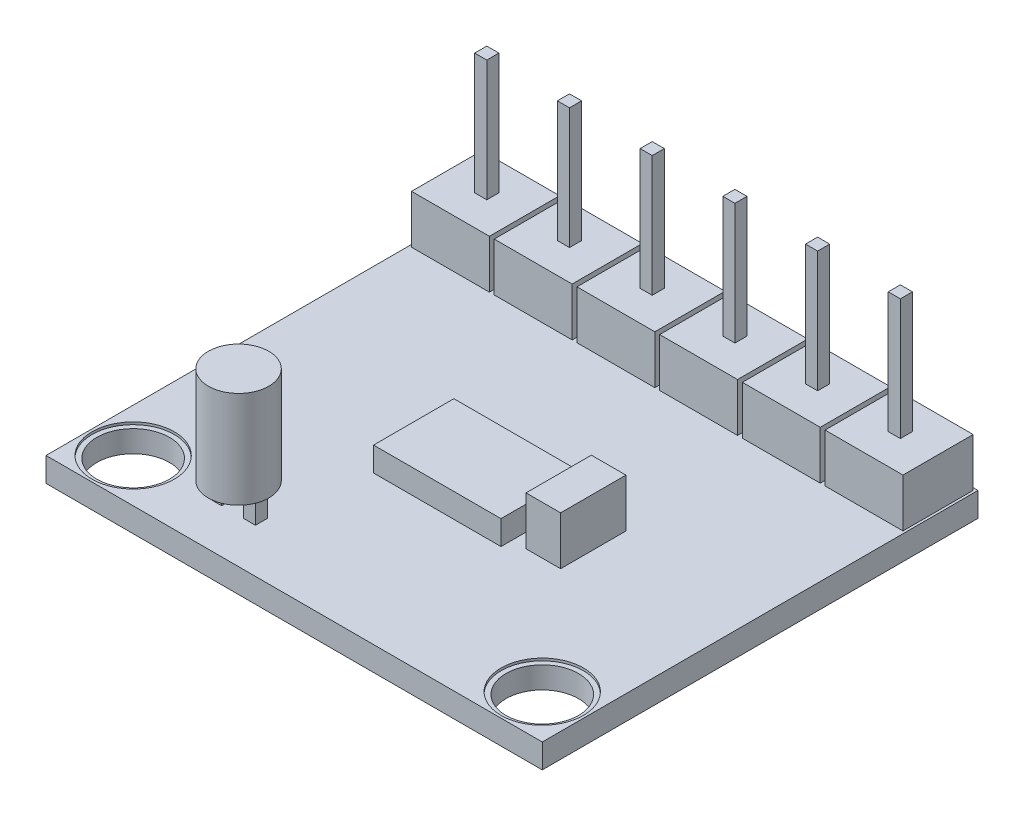
from build123d import *

# Parameters (mm, degrees)
SKETCH_1_W          = 20.5
SKETCH_1_H          = 18
EXTRUDE_1_DEPTH     = 1
SKETCH_2_W          = 3.216666667
SKETCH_2_H          = 3
SKETCH_2_W_2        = 3.216666666
EXTRUDE_2_DEPTH     = 2
SKETCH_3_W          = 0.5
SKETCH_3_H          = 0.5
EXTRUDE_3_DEPTH     = 5
EXTRUDE_3_2_DEPTH   = 5
EXTRUDE_3_3_DEPTH   = 5
EXTRUDE_3_4_DEPTH   = 5
EXTRUDE_3_5_DEPTH   = 5
EXTRUDE_3_6_DEPTH   = 5
SKETCH_4_W          = 20.3
SKETCH_4_H          = 0.1
CUT_EXTRUDE_1_DEPTH = 2
SKETCH_5_R          = 1.5
CUT_EXTRUDE_2_DEPTH = 22
SKETCH_6_R          = 1.7
SKETCH_6_R_2        = 1.5
CUT_EXTRUDE_3_DEPTH = 0.1
SKETCH_7_W          = 0.5
SKETCH_7_H          = 0.5
EXTRUDE_4_DEPTH     = 1
EXTRUDE_4_2_DEPTH   = 1
SKETCH_8_R          = 1.25
EXTRUDE_5_DEPTH     = 4
SKETCH_9_W          = 5.263405332
SKETCH_9_H          = 3.317744814
EXTRUDE_6_DEPTH     = 1
SKETCH_10_W         = 1.428317259
SKETCH_10_H         = 2.699182221
EXTRUDE_7_DEPTH     = 2


with BuildPart() as part:
    # 스케치1 → 보스-돌출1 (new body)
    with BuildSketch(Plane(origin=(0, 0, 0), x_dir=(1, 0, 0), z_dir=(0, 1, 0))):
        Rectangle(SKETCH_1_W, SKETCH_1_H)
    extrude(amount=EXTRUDE_1_DEPTH)

    # 스케치2 → 보스-돌출2 (add)
    with BuildSketch(Plane(origin=(0, 1, 0), x_dir=(1, 0, 0), z_dir=(0, 1, 0))):
        with Locations((-8.541666666, 7.5)):
            Rectangle(SKETCH_2_W, SKETCH_2_H)
        with Locations((-5.125, 7.5)):
            Rectangle(SKETCH_2_W_2, SKETCH_2_H)
        with Locations((-1.708333334, 7.5)):
            Rectangle(SKETCH_2_W, SKETCH_2_H)
        with Locations((1.708333334, 7.5)):
            Rectangle(SKETCH_2_W, SKETCH_2_H)
        with Locations((5.125, 7.5)):
            Rectangle(SKETCH_2_W_2, SKETCH_2_H)
        with Locations((8.541666666, 7.5)):
            Rectangle(SKETCH_2_W, SKETCH_2_H)
    extrude(amount=EXTRUDE_2_DEPTH)

    # 스케치4 → 컷-돌출1 (cut)
    with BuildSketch(Plane(origin=(0, 3, 0), x_dir=(1, 0, 0), z_dir=(0, 1, 0))):
        with Locations((0, 8.95)):
            Rectangle(SKETCH_4_W, SKETCH_4_H)
    extrude(amount=-CUT_EXTRUDE_1_DEPTH, mode=Mode.SUBTRACT)

    # 스케치5 → 컷-돌출2 (cut)
    with BuildSketch(Plane(origin=(0, 1, 0), x_dir=(1, 0, 0), z_dir=(0, 1, 0))):
        with Locations(Location((-8.45, -7.2, 0), (0, 0, 270))):
            Circle(SKETCH_5_R)
        with Locations(Location((8.45, -7.2, 0), (0, 0, 270))):
            Circle(SKETCH_5_R)
    extrude(amount=-CUT_EXTRUDE_2_DEPTH, mode=Mode.SUBTRACT)

    # 스케치6 → 컷-돌출3 (cut)
    # profile 1 of 2: a face of its own
    with BuildSketch(Plane(origin=(0, 1, 0), x_dir=(1, 0, 0), z_dir=(0, 1, 0))):
        with Locations(Location((-8.45, -7.2, 0), (0, 0, 270))):
            Circle(SKETCH_6_R)
        with Locations(Location((-8.45, -7.2, 0), (0, 0, 270))):
            Circle(SKETCH_6_R_2, mode=Mode.SUBTRACT)
    # profile 2 of 2: a face of its own
    with BuildSketch(Plane(origin=(0, 1, 0), x_dir=(1, 0, 0), z_dir=(0, 1, 0))):
        with Locations(Location((8.45, -7.2, 0), (0, 0, 270))):
            Circle(SKETCH_6_R)
        with Locations(Location((8.45, -7.2, 0), (0, 0, 270))):
            Circle(SKETCH_6_R_2, mode=Mode.SUBTRACT)
    extrude(amount=-CUT_EXTRUDE_3_DEPTH, mode=Mode.SUBTRACT)


with BuildPart() as body_2:
    # 스케치3 → 보스-돌출3 (new body)
    with BuildSketch(Plane(origin=(0, 3, 0), x_dir=(1, 0, 0), z_dir=(0, 1, 0))):
        with Locations((-8.541666667, 7.5)):
            Rectangle(SKETCH_3_W, SKETCH_3_H)
    extrude(amount=EXTRUDE_3_DEPTH)


with BuildPart() as body_3:
    # 스케치3 → Extrude 3 2 (new body)
    with BuildSketch(Plane(origin=(0, 3, 0), x_dir=(1, 0, 0), z_dir=(0, 1, 0))):
        with Locations((-5.125, 7.5)):
            Rectangle(SKETCH_3_W, SKETCH_3_H)
    extrude(amount=EXTRUDE_3_2_DEPTH)


with BuildPart() as body_4:
    # 스케치3 → Extrude 3 3 (new body)
    with BuildSketch(Plane(origin=(0, 3, 0), x_dir=(1, 0, 0), z_dir=(0, 1, 0))):
        with Locations((-1.708333333, 7.5)):
            Rectangle(SKETCH_3_W, SKETCH_3_H)
    extrude(amount=EXTRUDE_3_3_DEPTH)


with BuildPart() as body_5:
    # 스케치3 → Extrude 3 4 (new body)
    with BuildSketch(Plane(origin=(0, 3, 0), x_dir=(1, 0, 0), z_dir=(0, 1, 0))):
        with Locations((1.708333333, 7.5)):
            Rectangle(SKETCH_3_W, SKETCH_3_H)
    extrude(amount=EXTRUDE_3_4_DEPTH)


with BuildPart() as body_6:
    # 스케치3 → Extrude 3 5 (new body)
    with BuildSketch(Plane(origin=(0, 3, 0), x_dir=(1, 0, 0), z_dir=(0, 1, 0))):
        with Locations((5.125, 7.5)):
            Rectangle(SKETCH_3_W, SKETCH_3_H)
    extrude(amount=EXTRUDE_3_5_DEPTH)


with BuildPart() as body_7:
    # 스케치3 → Extrude 3 6 (new body)
    with BuildSketch(Plane(origin=(0, 3, 0), x_dir=(1, 0, 0), z_dir=(0, 1, 0))):
        with Locations((8.541666667, 7.5)):
            Rectangle(SKETCH_3_W, SKETCH_3_H)
    extrude(amount=EXTRUDE_3_6_DEPTH)


with BuildPart() as body_8:
    # 스케치7 → 보스-돌출4 (new body)
    with BuildSketch(Plane(origin=(0, 1, 0), x_dir=(1, 0, 0), z_dir=(0, 1, 0))):
        with Locations((-3.675579376, -6.920991379)):
            Rectangle(SKETCH_7_W, SKETCH_7_H)
    extrude(amount=EXTRUDE_4_DEPTH)


with BuildPart() as body_9:
    # 스케치7 → Extrude 4 2 (new body)
    with BuildSketch(Plane(origin=(0, 1, 0), x_dir=(1, 0, 0), z_dir=(0, 1, 0))):
        with Locations((-5.075579376, -6.920991379)):
            Rectangle(SKETCH_7_W, SKETCH_7_H)
    extrude(amount=EXTRUDE_4_2_DEPTH)


with BuildPart() as body_10:
    # 스케치8 → 보스-돌출5 (new body)
    with BuildSketch(Plane(origin=(0, 2, 0), x_dir=(1, 0, 0), z_dir=(0, 1, 0))):
        with Locations(Location((-4.375579376, -6.920991379, 0), (0, 0, 270))):
            Circle(SKETCH_8_R)
    extrude(amount=EXTRUDE_5_DEPTH)


with BuildPart() as body_11:
    # 스케치9 → 보스-돌출6 (new body)
    with BuildSketch(Plane(origin=(0, 1, 0), x_dir=(1, 0, 0), z_dir=(0, 1, 0))):
        with Locations((-0.224931852, -1.203385407)):
            Rectangle(SKETCH_9_W, SKETCH_9_H)
    extrude(amount=EXTRUDE_6_DEPTH)


with BuildPart() as body_12:
    # 스케치10 → 보스-돌출7 (new body)
    with BuildSketch(Plane(origin=(0, 1, 0), x_dir=(1, 0, 0), z_dir=(0, 1, 0))):
        with Locations((3.716998851, -1.074049593)):
            Rectangle(SKETCH_10_W, SKETCH_10_H)
    extrude(amount=EXTRUDE_7_DEPTH)


solid = Compound([part.part, body_2.part, body_3.part, body_4.part, body_5.part, body_6.part, body_7.part, body_8.part, body_9.part, body_10.part, body_11.part, body_12.part])
